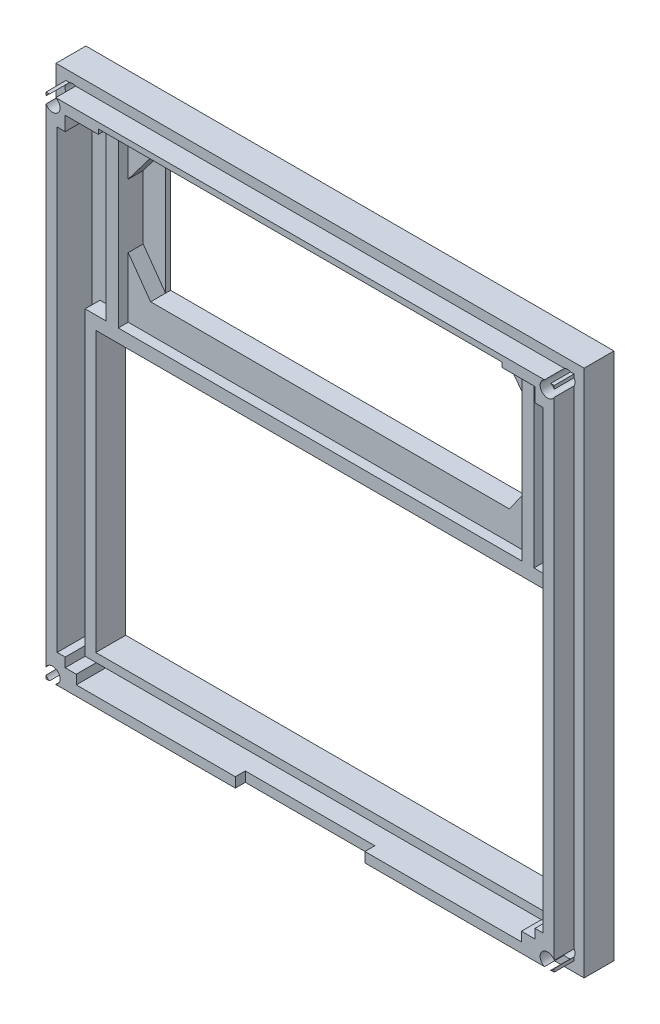
from build123d import *

# Parameters (mm, degrees)
SKETCH_1_W          = 106
SKETCH_1_H          = 106
SKETCH_1_R          = 1.5
SKETCH_1_W_2        = 72
SKETCH_1_H_2        = 25
SKETCH_1_W_3        = 90
SKETCH_1_H_3        = 56
EXTRUDE_1_DEPTH     = 10
SKETCH_2_W          = 106
SKETCH_2_H          = 106
SKETCH_2_W_2        = 102
SKETCH_2_H_2        = 102
CUT_EXTRUDE_1_DEPTH = 4
SKETCH_3_W          = 81
SKETCH_3_H          = 36.6
CUT_EXTRUDE_2_DEPTH = 6
SKETCH_4_W          = 89.344385993
SKETCH_4_H          = 1.858759764
CUT_EXTRUDE_3_DEPTH = 7
CUT_EXTRUDE_4_DEPTH = 4
CUT_EXTRUDE_5_DEPTH = 3
SKETCH_8_W          = 26
SKETCH_8_H          = 17.490205858
CUT_EXTRUDE_6_DEPTH = 2


with BuildPart() as part:
    # 草图1 → 凸台-拉伸1 (new body)
    with BuildSketch(Plane.XY):
        with Locations((53, 53)):
            Rectangle(SKETCH_1_W, SKETCH_1_H)
        with Locations((3.324461644, 102.636394846)):
            Circle(SKETCH_1_R, mode=Mode.SUBTRACT)
        with Locations(Location((102.675538356, 102.636394846, 0), (0, 0, 180))):
            Circle(SKETCH_1_R, mode=Mode.SUBTRACT)
        with Locations((102.675538356, 3.363605154)):
            Circle(SKETCH_1_R, mode=Mode.SUBTRACT)
        with Locations(Location((3.324461644, 3.363605154, 0), (0, 0, 180))):
            Circle(SKETCH_1_R, mode=Mode.SUBTRACT)
        with Locations((53, 84.537117037)):
            Rectangle(SKETCH_1_W_2, SKETCH_1_H_2, mode=Mode.SUBTRACT)
        with Locations((53, 35.575547917)):
            Rectangle(SKETCH_1_W_3, SKETCH_1_H_3, mode=Mode.SUBTRACT)
    extrude(amount=EXTRUDE_1_DEPTH)

    # 草图2 → 切除-拉伸1 (cut)
    with BuildSketch(Plane.XY.offset(10)):
        with Locations((53, 53)):
            Rectangle(SKETCH_2_W, SKETCH_2_H)
        with Locations((53, 53)):
            Rectangle(SKETCH_2_W_2, SKETCH_2_H_2, mode=Mode.SUBTRACT)
    extrude(amount=-CUT_EXTRUDE_1_DEPTH, mode=Mode.SUBTRACT)

    # 草图3 → 切除-拉伸2 (cut)
    with BuildSketch(Plane.XY.offset(10)):
        with Locations((53, 84.537117037)):
            Rectangle(SKETCH_3_W, SKETCH_3_H)
    extrude(amount=-CUT_EXTRUDE_2_DEPTH, mode=Mode.SUBTRACT)

    # 草图4 → 切除-拉伸3 (cut)
    with BuildSketch(Plane.XY.offset(10)):
        Polygon((4.238535523, 99.03528349), (5.849460651, 99.03528349), (5.849460651, 101.885381795), (10.06264945, 101.885381795), (10.06264945, 66.237117037), (5.849460651, 66.237117037), (5.849460651, 7.708220416), (4.238535523, 7.708220416), align=None)
        Polygon((95.93735055, 66.237117037), (100.150539349, 66.237117037), (100.150539349, 7.708220416), (101.761464477, 7.708220416), (101.761464477, 99.03528349), (100.150539349, 99.03528349), (100.150539349, 101.885381795), (95.93735055, 101.885381795), align=None)
        with Locations((52.752165365, 4.920080769)):
            Rectangle(SKETCH_4_W, SKETCH_4_H)
    extrude(amount=-CUT_EXTRUDE_3_DEPTH, mode=Mode.SUBTRACT)

    # 草图5 → 切除-拉伸4 (cut)
    with BuildSketch(Plane.XY.offset(10)):
        Polygon((7.956055051, 101.885381795), (98.043944949, 101.885381795), (98.043944949, 66.237117037), (100.150539349, 66.237117037), (100.150539349, 5.849460651), (5.849460651, 5.849460651), (5.849460651, 66.237117037), (7.956055051, 66.237117037), align=None)
    extrude(amount=-CUT_EXTRUDE_4_DEPTH, mode=Mode.SUBTRACT)

    # 草图6 → 切除-拉伸5 (cut)
    with BuildSketch(Plane.XY.offset(4)):
        Polygon((17, 97.037117037), (12.5, 91.104575163), (12.5, 78.34109145), (17, 72.037117037), align=None)
        Polygon((89, 72.037117037), (89, 97.037117037), (93.5, 91.104575163), (93.5, 78.34109145), align=None)
    extrude(amount=-CUT_EXTRUDE_5_DEPTH, mode=Mode.SUBTRACT)

    # 草图8 → 切除-拉伸6 (cut)
    with BuildSketch(Plane.XY.offset(10)):
        with Locations((53, 3.253738618)):
            Rectangle(SKETCH_8_W, SKETCH_8_H)
    extrude(amount=-CUT_EXTRUDE_6_DEPTH, mode=Mode.SUBTRACT)


solid = part.part
